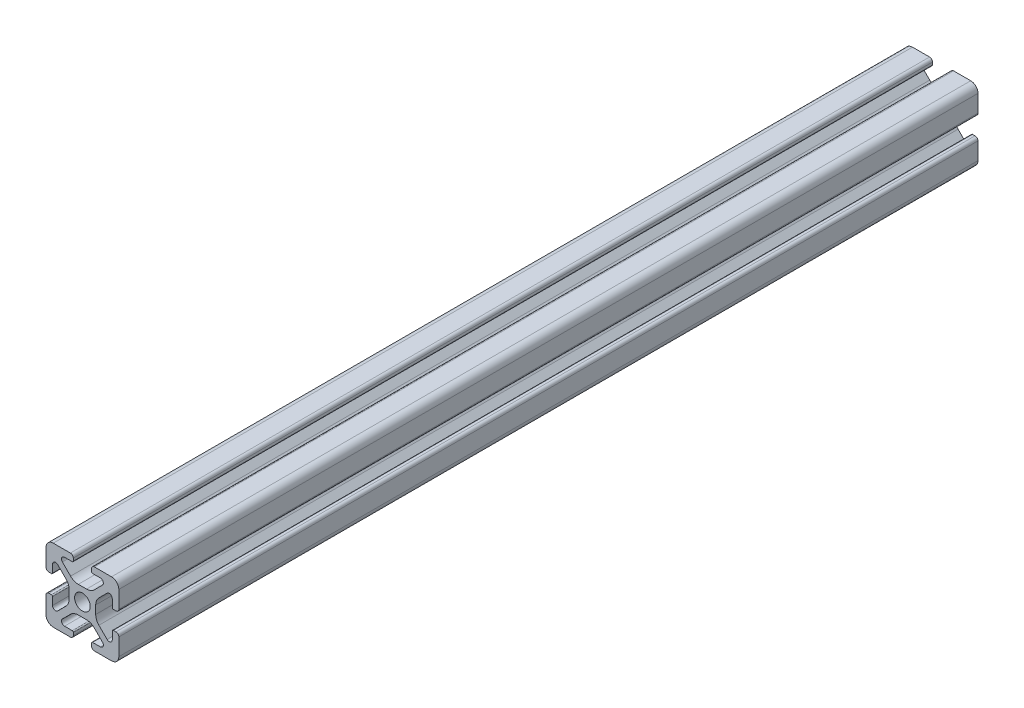
from build123d import *

# Parameters (mm, degrees)
ESQUISSE1_R      = 2.15
EXTRUSION1_DEPTH = 236


with BuildPart() as part:
    # Esquisse1 → Extrusion1 (new body)
    with BuildSketch(Plane(origin=(0, 0, 0), x_dir=(-1, 0, 0), z_dir=(0, 0, -1))):
        with BuildLine():
            Line((-18, 0), (-13.3, 0))
            ThreePointArc((-13.3, 0), (-12.734314575, 0.234314575), (-12.5, 0.8))
            Line((-12.5, 0.8), (-12.5, 1.5))
            ThreePointArc((-12.5, 1.5), (-12.587867966, 1.712132034), (-12.8, 1.8))
            Line((-12.8, 1.8), (-14.918424061, 1.8))
            ThreePointArc((-14.918424061, 1.8), (-15.686700051, 2.313345604), (-15.506437047, 3.219588924))
            Line((-15.506437047, 3.219588924), (-13.254705627, 5.471320344))
            ThreePointArc((-13.254705627, 5.471320344), (-12.281435581, 6.121638598), (-11.133385284, 6.35))
            Line((-11.133385284, 6.35), (-8.866614716, 6.35))
            ThreePointArc((-8.866614716, 6.35), (-7.718564419, 6.121638598), (-6.745294373, 5.471320344))
            Line((-6.745294373, 5.471320344), (-4.493562953, 3.219588924))
            ThreePointArc((-4.493562953, 3.219588924), (-4.313299949, 2.313345604), (-5.081575939, 1.8))
            Line((-5.081575939, 1.8), (-7.2, 1.8))
            ThreePointArc((-7.2, 1.8), (-7.412132034, 1.712132034), (-7.5, 1.5))
            Line((-7.5, 1.5), (-7.5, 0.8))
            ThreePointArc((-7.5, 0.8), (-7.265685425, 0.234314575), (-6.7, 0))
            Line((-6.7, 0), (-2, 0))
            ThreePointArc((-2, 0), (-0.585786438, 0.585786438), (0, 2))
            Line((0, 2), (0, 6.7))
            ThreePointArc((0, 6.7), (-0.234314575, 7.265685425), (-0.8, 7.5))
            Line((-0.8, 7.5), (-1.5, 7.5))
            ThreePointArc((-1.5, 7.5), (-1.712132034, 7.412132034), (-1.8, 7.2))
            Line((-1.8, 7.2), (-1.8, 5.081575939))
            ThreePointArc((-1.8, 5.081575939), (-2.313345604, 4.313299949), (-3.219588924, 4.493562953))
            Line((-3.219588924, 4.493562953), (-5.471320344, 6.745294373))
            ThreePointArc((-5.471320344, 6.745294373), (-6.121638598, 7.718564419), (-6.35, 8.866614716))
            Line((-6.35, 8.866614716), (-6.35, 11.133385284))
            ThreePointArc((-6.35, 11.133385284), (-6.121638598, 12.281435581), (-5.471320344, 13.254705627))
            Line((-5.471320344, 13.254705627), (-3.219588924, 15.506437047))
            ThreePointArc((-3.219588924, 15.506437047), (-2.313345604, 15.686700051), (-1.8, 14.918424061))
            Line((-1.8, 14.918424061), (-1.8, 12.8))
            ThreePointArc((-1.8, 12.8), (-1.712132034, 12.587867966), (-1.5, 12.5))
            Line((-1.5, 12.5), (-0.8, 12.5))
            ThreePointArc((-0.8, 12.5), (-0.234314575, 12.734314575), (0, 13.3))
            Line((0, 13.3), (0, 18))
            ThreePointArc((0, 18), (-0.585786438, 19.414213562), (-2, 20))
            Line((-2, 20), (-6.7, 20))
            ThreePointArc((-6.7, 20), (-7.265685425, 19.765685425), (-7.5, 19.2))
            Line((-7.5, 19.2), (-7.5, 18.5))
            ThreePointArc((-7.5, 18.5), (-7.412132034, 18.287867966), (-7.2, 18.2))
            Line((-7.2, 18.2), (-5.081575939, 18.2))
            ThreePointArc((-5.081575939, 18.2), (-4.313299949, 17.686654396), (-4.493562953, 16.780411076))
            Line((-4.493562953, 16.780411076), (-6.745294373, 14.528679656))
            ThreePointArc((-6.745294373, 14.528679656), (-7.718564419, 13.878361402), (-8.866614716, 13.65))
            Line((-8.866614716, 13.65), (-11.133385284, 13.65))
            ThreePointArc((-11.133385284, 13.65), (-12.281435581, 13.878361402), (-13.254705627, 14.528679656))
            Line((-13.254705627, 14.528679656), (-15.506437047, 16.780411076))
            ThreePointArc((-15.506437047, 16.780411076), (-15.686700051, 17.686654396), (-14.918424061, 18.2))
            Line((-14.918424061, 18.2), (-12.8, 18.2))
            ThreePointArc((-12.8, 18.2), (-12.587867966, 18.287867966), (-12.5, 18.5))
            Line((-12.5, 18.5), (-12.5, 19.2))
            ThreePointArc((-12.5, 19.2), (-12.734314575, 19.765685425), (-13.3, 20))
            Line((-13.3, 20), (-18, 20))
            ThreePointArc((-18, 20), (-19.414213562, 19.414213562), (-20, 18))
            Line((-20, 18), (-20, 13.3))
            ThreePointArc((-20, 13.3), (-19.765685425, 12.734314575), (-19.2, 12.5))
            Line((-19.2, 12.5), (-18.5, 12.5))
            ThreePointArc((-18.5, 12.5), (-18.287867966, 12.587867966), (-18.2, 12.8))
            Line((-18.2, 12.8), (-18.2, 14.918424061))
            ThreePointArc((-18.2, 14.918424061), (-17.686654396, 15.686700051), (-16.780411076, 15.506437047))
            Line((-16.780411076, 15.506437047), (-14.528679656, 13.254705627))
            ThreePointArc((-14.528679656, 13.254705627), (-13.878361402, 12.281435581), (-13.65, 11.133385284))
            Line((-13.65, 11.133385284), (-13.65, 8.866614716))
            ThreePointArc((-13.65, 8.866614716), (-13.878361402, 7.718564419), (-14.528679656, 6.745294373))
            Line((-14.528679656, 6.745294373), (-16.780411076, 4.493562953))
            ThreePointArc((-16.780411076, 4.493562953), (-17.686654396, 4.313299949), (-18.2, 5.081575939))
            Line((-18.2, 5.081575939), (-18.2, 7.2))
            ThreePointArc((-18.2, 7.2), (-18.287867966, 7.412132034), (-18.5, 7.5))
            Line((-18.5, 7.5), (-19.2, 7.5))
            ThreePointArc((-19.2, 7.5), (-19.765685425, 7.265685425), (-20, 6.7))
            Line((-20, 6.7), (-20, 2))
            ThreePointArc((-20, 2), (-19.414213562, 0.585786438), (-18, 0))
        make_face()
        with Locations(Location((-10, 10, 0), (0, 0, 180))):
            Circle(ESQUISSE1_R, mode=Mode.SUBTRACT)
    extrude(amount=-EXTRUSION1_DEPTH)


solid = part.part
